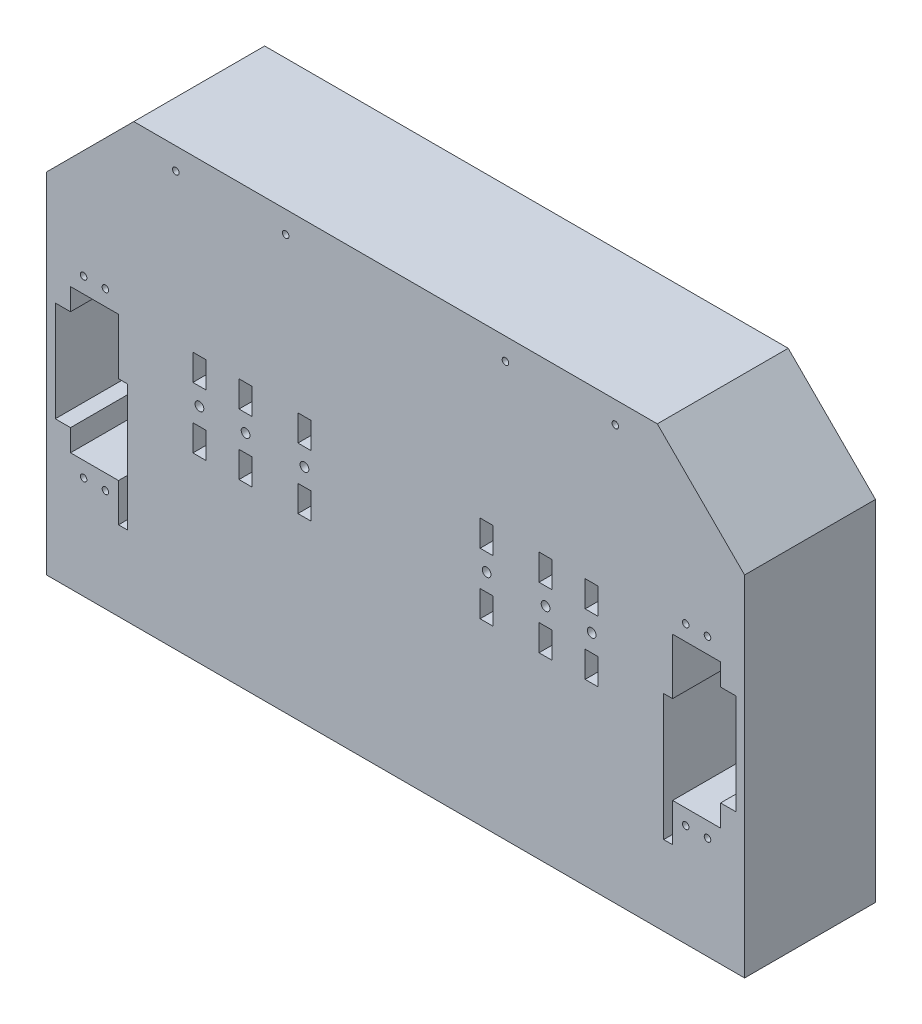
from build123d import *

# Parameters (mm, degrees)
ESQUISSE1_W             = 320
ESQUISSE1_H             = 200
BOSS_EXTRU_1_DEPTH      = 60
ESQUISSE3_R             = 2
ESQUISSE3_W             = 6
ESQUISSE3_H             = 12
ENL_V_MAT_EXTRU_2_DEPTH = 60
CHANFREIN1_SIZE         = 40
ESQUISSE6_R             = 1.5
ENL_V_MAT_EXTRU_3_DEPTH = 60


with BuildPart() as part:
    # Esquisse1 → Boss.-Extru.1 (new body)
    with BuildSketch(Plane.XY):
        with Locations((-160, 100)):
            Rectangle(ESQUISSE1_W, ESQUISSE1_H)
    extrude(amount=BOSS_EXTRU_1_DEPTH)

    # Esquisse3 → Enlèv. mat.-Extru.2 (cut)
    with BuildSketch(Plane(origin=(0, 0, 0), x_dir=(-1, 0, 0), z_dir=(0, 0, -1))):
        with Locations((70.1, 102)):
            Circle(ESQUISSE3_R)
        with Locations((91.24, 102)):
            Circle(ESQUISSE3_R)
        with Locations((118.24, 102)):
            Circle(ESQUISSE3_R)
        with Locations(Location((201.76, 102, 0), (0, 0, 180))):
            Circle(ESQUISSE3_R)
        with Locations(Location((228.76, 102, 0), (0, 0, 180))):
            Circle(ESQUISSE3_R)
        with Locations(Location((249.9, 102, 0), (0, 0, 180))):
            Circle(ESQUISSE3_R)
        with Locations((70.1, 88)):
            Rectangle(ESQUISSE3_W, ESQUISSE3_H)
        with Locations((70.1, 116)):
            Rectangle(ESQUISSE3_W, ESQUISSE3_H)
        with Locations((91.24, 88)):
            Rectangle(ESQUISSE3_W, ESQUISSE3_H)
        with Locations((91.24, 116)):
            Rectangle(ESQUISSE3_W, ESQUISSE3_H)
        with Locations((118.24, 88)):
            Rectangle(ESQUISSE3_W, ESQUISSE3_H)
        with Locations((118.24, 116)):
            Rectangle(ESQUISSE3_W, ESQUISSE3_H)
        with Locations((201.76, 88)):
            Rectangle(ESQUISSE3_W, ESQUISSE3_H)
        with Locations((201.76, 116)):
            Rectangle(ESQUISSE3_W, ESQUISSE3_H)
        with Locations((228.76, 88)):
            Rectangle(ESQUISSE3_W, ESQUISSE3_H)
        with Locations((228.76, 116)):
            Rectangle(ESQUISSE3_W, ESQUISSE3_H)
        with Locations((249.9, 88)):
            Rectangle(ESQUISSE3_W, ESQUISSE3_H)
        with Locations((249.9, 116)):
            Rectangle(ESQUISSE3_W, ESQUISSE3_H)
    extrude(amount=-ENL_V_MAT_EXTRU_2_DEPTH, mode=Mode.SUBTRACT)

    # Chanfrein1
    chanfrein1_edges = [part.edges().sort_by_distance(p)[0] for p in [
        (-320, 200, 30),
        (0, 200, 30),
    ]]
    chamfer(chanfrein1_edges, length=CHANFREIN1_SIZE)

    # Esquisse6 → Enlèv. mat.-Extru.3 (cut)
    with BuildSketch(Plane.XY.offset(60)):
        with Locations((-260.750206469, 189.977960498)):
            Circle(ESQUISSE6_R)
        with Locations((-210.375103235, 189.977960498)):
            Circle(ESQUISSE6_R)
        with Locations(Location((-109.624896765, 189.977960498, 0), (0, 0, 180))):
            Circle(ESQUISSE6_R)
        with Locations(Location((-59.249793531, 189.977960498, 0), (0, 0, 180))):
            Circle(ESQUISSE6_R)
        with Locations((-303, 47)):
            Circle(ESQUISSE6_R)
        with Locations((-293, 47)):
            Circle(ESQUISSE6_R)
        with Locations(Location((-293, 127.148940914, 0), (0, 0, 180))):
            Circle(ESQUISSE6_R)
        with Locations(Location((-303, 127.148940914, 0), (0, 0, 180))):
            Circle(ESQUISSE6_R)
        with Locations(Location((-27, 47, 0), (0, 0, 180))):
            Circle(ESQUISSE6_R)
        with Locations(Location((-17, 47, 0), (0, 0, 180))):
            Circle(ESQUISSE6_R)
        with Locations((-17, 127.148940914)):
            Circle(ESQUISSE6_R)
        with Locations((-27, 127.148940914)):
            Circle(ESQUISSE6_R)
        Polygon((-287, 120), (-309, 120), (-309, 110), (-316, 110), (-316, 64), (-309, 64), (-309, 54), (-287, 54), (-287, 36.405681604), (-282.9, 36.405681604), (-282.9, 94.405681604), (-287, 94.405681604), align=None)
        Polygon((-33, 36.405681604), (-33, 54), (-11, 54), (-11, 64), (-4, 64), (-4, 110), (-11, 110), (-11, 120), (-33, 120), (-33, 94.405681604), (-37.1, 94.405681604), (-37.1, 36.405681604), align=None)
    extrude(amount=-ENL_V_MAT_EXTRU_3_DEPTH, mode=Mode.SUBTRACT)


solid = part.part
